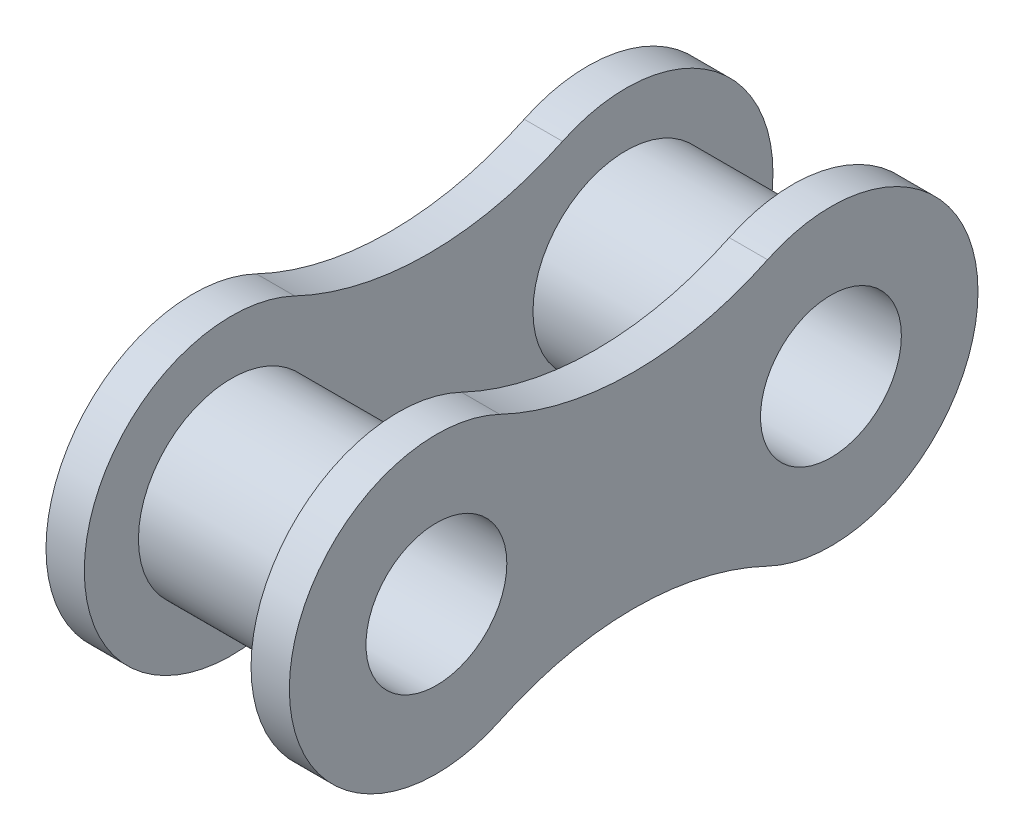
from build123d import *

# Parameters (mm, degrees)
SKETCH_1_R        = 8.975
SKETCH_1_R_2      = 6.8
EXTRUDE_1_DEPTH   = 11.75
EXTRUDE_1_2_DEPTH = 11.75
SKETCH_3_R        = 8.975
EXTRUDE_4_DEPTH   = 3.7


with BuildPart() as part:
    # Эскиз1 → Бобышка-Вытянуть1 (new, symmetric)
    with BuildSketch(Plane(origin=(0, 0, 0), x_dir=(0, 0, -1), z_dir=(1, 0, 0))):
        with Locations((-19.05, 0)):
            Circle(SKETCH_1_R)
        with Locations((-19.05, 0)):
            Circle(SKETCH_1_R_2, mode=Mode.SUBTRACT)
    extrude(amount=EXTRUDE_1_DEPTH, both=True)



with BuildPart() as body_2:
    # Эскиз1 → Extrude 1 2 (new, symmetric)
    with BuildSketch(Plane(origin=(0, 0, 0), x_dir=(0, 0, -1), z_dir=(1, 0, 0))):
        with Locations((19.05, 0)):
            Circle(SKETCH_1_R)
        with Locations((19.05, 0)):
            Circle(SKETCH_1_R_2, mode=Mode.SUBTRACT)
    extrude(amount=EXTRUDE_1_2_DEPTH, both=True)


with BuildPart() as part_1:
    add(part.part)

    add(body_2.part)  # Бобышка-Вытянуть4 merges body 2
    # Эскиз3 → Бобышка-Вытянуть4 (add)
    with BuildSketch(Plane(origin=(11.75, 0, 0), x_dir=(0, 0, -1), z_dir=(1, 0, 0))):
        with BuildLine():
            ThreePointArc((12.929864253, -12.813428052), (33.25, 0), (12.929864253, 12.813428052))
            ThreePointArc((12.929864253, 12.813428052), (0, 9.884050697), (-12.929864253, 12.813428052))
            ThreePointArc((-12.929864253, 12.813428052), (-33.25, 0), (-12.929864253, -12.813428052))
            ThreePointArc((-12.929864253, -12.813428052), (0, -9.884050697), (12.929864253, -12.813428052))
        make_face()
        with Locations((-19.05, 0)):
            Circle(SKETCH_3_R, mode=Mode.SUBTRACT)
        with Locations((19.05, 0)):
            Circle(SKETCH_3_R, mode=Mode.SUBTRACT)
    extrude_4 = extrude(amount=-EXTRUDE_4_DEPTH)

    # Зеркальное отражение10: Бобышка-Вытянуть4 across plane
    add(extrude_4.mirror(Plane(origin=(0, 0, 0), x_dir=(0, 0, 1), z_dir=(1, 0, 0))))


solid = part_1.part
